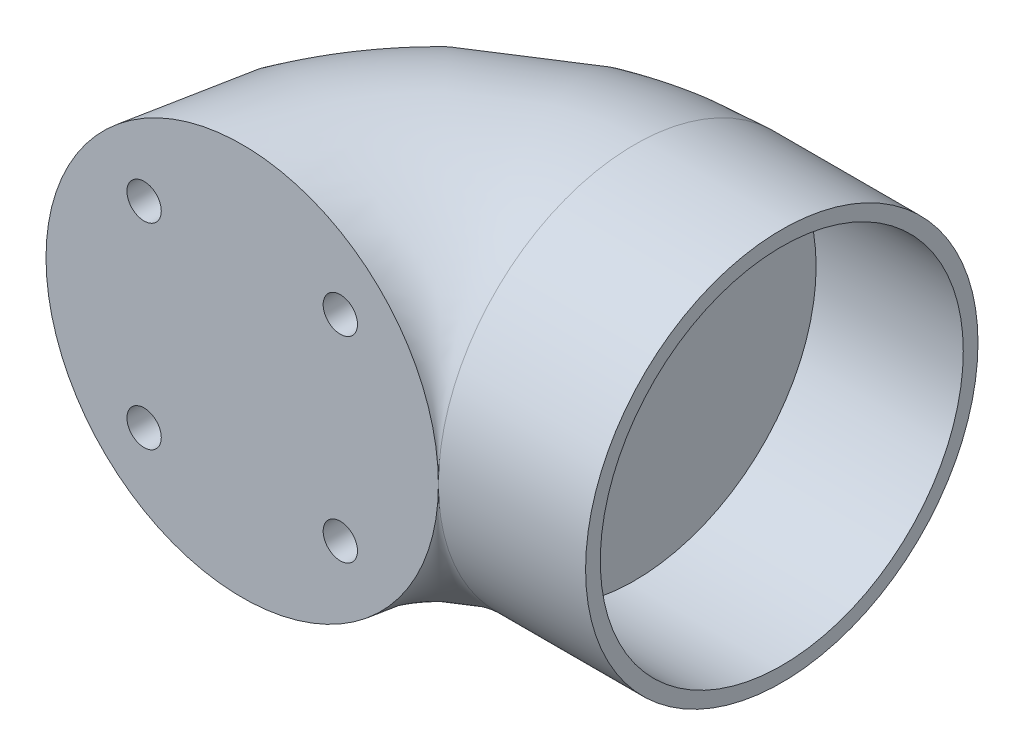
from build123d import *

# Parameters (mm, degrees)
SKETCH_1_R          = 20
SKETCH_3_R          = 20
SKETCH_3_R_2        = 18.5
EXTRUDE_1_DEPTH     = 15
CUT_EXTRUDE_1_DEPTH = 57.789083564
CUT_EXTRUDE_2_DEPTH = 35


with BuildPart() as part:
    # 扫描1: sweep along a path in 草图2
    with BuildLine(Plane(origin=(0, 0, 0), x_dir=(1, 0, 0), z_dir=(0, 1, 0))) as sweep_1_path:
        ThreePointArc((20, 20), (5.857864376, 14.142135624), (0, 0))
    # 草图1 → 扫描1 (sweep)
    with BuildSketch(Plane.XY):
        Circle(SKETCH_1_R)
    sweep(path=sweep_1_path.line)

    # 草图3 → 凸台-拉伸1 (add)
    with BuildSketch(Plane(origin=(20, 0, 0), x_dir=(0, 0, -1), z_dir=(1, 0, 0))):
        with Locations(Location((20, 0, 0), (0, 0, 180))):
            Circle(SKETCH_3_R)
        with Locations((20, 0)):
            Circle(SKETCH_3_R_2, mode=Mode.SUBTRACT)
    extrude(amount=EXTRUDE_1_DEPTH)

    # 草图4 → 切除-拉伸1 (cut, through all)
    with BuildSketch(Plane.XY):
        with BuildLine():
            Line((-10, 8.25), (-10, 10))
            Line((-10, 10), (-8.25, 10))
            ThreePointArc((-8.25, 10), (-11.237436867, 11.237436867), (-10, 8.25))
        make_face()
        with BuildLine():
            Line((-8.25, 10), (-10, 10))
            Line((-10, 10), (-10, 8.25))
            ThreePointArc((-10, 8.25), (-8.762563133, 8.762563133), (-8.25, 10))
        make_face()
        with BuildLine():
            ThreePointArc((11.75, 10), (10, 11.75), (8.25, 10))
            Line((8.25, 10), (10, 10))
            Line((10, 10), (10, 8.25))
            ThreePointArc((10, 8.25), (11.237436867, 8.762563133), (11.75, 10))
        make_face()
        with BuildLine():
            Line((10, 10), (8.25, 10))
            ThreePointArc((8.25, 10), (8.762563133, 8.762563133), (10, 8.25))
            Line((10, 8.25), (10, 10))
        make_face()
        with BuildLine():
            ThreePointArc((11.75, -10), (11.237436867, -8.762563133), (10, -8.25))
            Line((10, -8.25), (10, -10))
            Line((10, -10), (8.25, -10))
            ThreePointArc((8.25, -10), (10, -11.75), (11.75, -10))
        make_face()
        with BuildLine():
            Line((10, -10), (10, -8.25))
            ThreePointArc((10, -8.25), (8.762563133, -8.762563133), (8.25, -10))
            Line((8.25, -10), (10, -10))
        make_face()
        with BuildLine():
            ThreePointArc((-8.25, -10), (-8.762563133, -8.762563133), (-10, -8.25))
            Line((-10, -8.25), (-10, -10))
            Line((-10, -10), (-8.25, -10))
        make_face()
        with BuildLine():
            Line((-10, -10), (-10, -8.25))
            ThreePointArc((-10, -8.25), (-11.237436867, -11.237436867), (-8.25, -10))
            Line((-8.25, -10), (-10, -10))
        make_face()
    extrude(amount=-CUT_EXTRUDE_1_DEPTH, mode=Mode.SUBTRACT)

    # 草图5 → 切除-拉伸2 (cut)
    with BuildSketch(Plane.XY.offset(-40)):
        with BuildLine():
            ThreePointArc((14, 10), (10, 14), (6, 10))
            Line((6, 10), (10, 10))
            Line((10, 10), (10, 6))
            ThreePointArc((10, 6), (12.828427125, 7.171572875), (14, 10))
        make_face()
        with BuildLine():
            Line((10, 10), (6, 10))
            ThreePointArc((6, 10), (7.171572875, 7.171572875), (10, 6))
            Line((10, 6), (10, 10))
        make_face()
        with BuildLine():
            Line((-10, 6), (-10, 10))
            Line((-10, 10), (-6, 10))
            ThreePointArc((-6, 10), (-12.828427125, 12.828427125), (-10, 6))
        make_face()
        with BuildLine():
            Line((-6, 10), (-10, 10))
            Line((-10, 10), (-10, 6))
            ThreePointArc((-10, 6), (-7.171572875, 7.171572875), (-6, 10))
        make_face()
        with BuildLine():
            ThreePointArc((14, -10), (12.828427125, -7.171572875), (10, -6))
            Line((10, -6), (10, -10))
            Line((10, -10), (6, -10))
            ThreePointArc((6, -10), (10, -14), (14, -10))
        make_face()
        with BuildLine():
            Line((10, -10), (10, -6))
            ThreePointArc((10, -6), (7.171572875, -7.171572875), (6, -10))
            Line((6, -10), (10, -10))
        make_face()
        with BuildLine():
            ThreePointArc((-6, -10), (-7.171572875, -7.171572875), (-10, -6))
            Line((-10, -6), (-10, -10))
            Line((-10, -10), (-6, -10))
        make_face()
        with BuildLine():
            Line((-10, -10), (-10, -6))
            ThreePointArc((-10, -6), (-12.828427125, -12.828427125), (-6, -10))
            Line((-6, -10), (-10, -10))
        make_face()
    extrude(amount=CUT_EXTRUDE_2_DEPTH, mode=Mode.SUBTRACT)


solid = part.part
